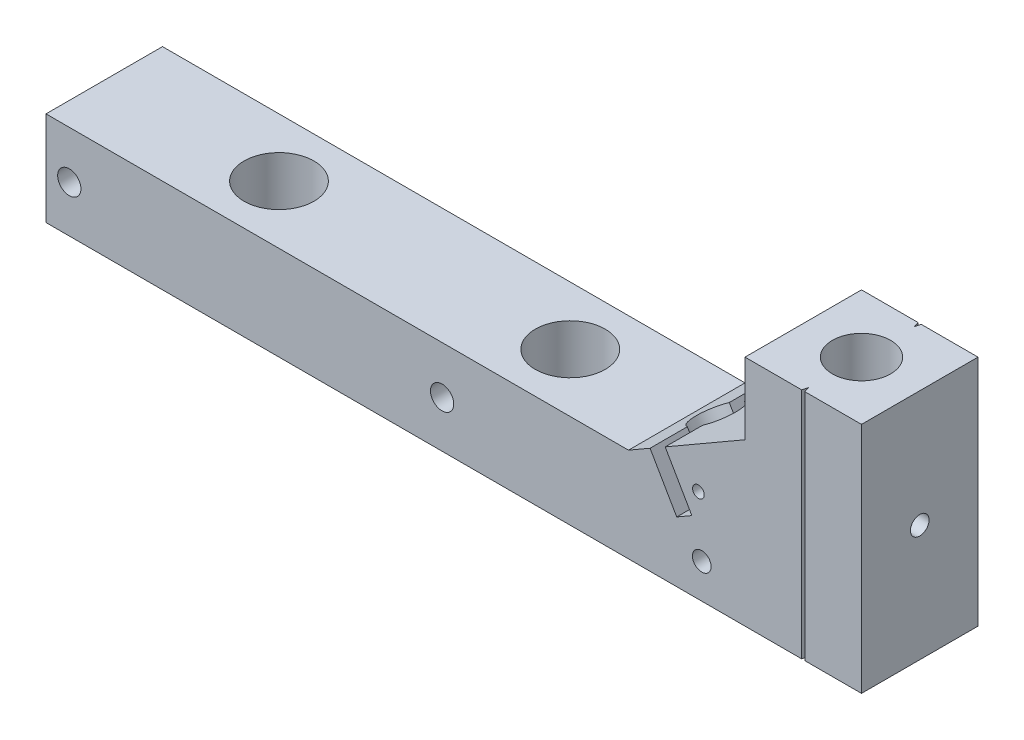
from build123d import *

# Parameters (mm, degrees)
SKETCH1_W                 = 20
SKETCH1_H                 = 10
BOSS_EXTRUDE1_DEPTH       = 20
SKETCH2_R                 = 2.5
CUT_EXTRUDE1_DEPTH        = 26.836409614
CUT_EXTRUDE2_DEPTH        = 27.191969955
SKETCH5_R                 = 1.95
CUT_EXTRUDE5_DEPTH        = 21.021203074
M2X0_4_TAPPED_HOLE1_D     = 1.6
M2X0_4_TAPPED_HOLE1_DEPTH = 6
M2X0_4_TAPPED_HOLE1_TIP   = 0.480688495
M2X0_4_TAPPED_HOLE2_D     = 1.6
M2X0_4_TAPPED_HOLE2_DEPTH = 6
M2X0_4_TAPPED_HOLE2_TIP   = 0.480688495
SKETCH14_W                = 10
SKETCH14_H                = 8.082903769
BOSS_EXTRUDE3_DEPTH       = 50
CUT_EXTRUDE7_REACH        = 67.371
SKETCH15_R                = 3
SKETCH16_R                = 1
CUT_EXTRUDE8_DEPTH        = 68.45300722
SKETCH18_R                = 0.5
CUT_EXTRUDE9_DEPTH        = 3


with BuildPart() as part:
    # Sketch1 → Boss-Extrude1 (new body)
    with BuildSketch(Plane(origin=(0, 0, 0), x_dir=(1, 0, 0), z_dir=(0, 1, 0))):
        with Locations((-3.638888889, 4.027777778)):
            Rectangle(SKETCH1_W, SKETCH1_H)
    extrude(amount=BOSS_EXTRUDE1_DEPTH)

    # Sketch2 → Cut-Extrude1 (cut, through all)
    with BuildSketch(Plane(origin=(0, 20, 0), x_dir=(1, 0, 0), z_dir=(0, 1, 0))):
        with Locations((1.361111111, 4.027777778)):
            Circle(SKETCH2_R)
        Polygon((1.495085707, -0.972222222), (1.361111111, -0.472222222), (1.227136515, -0.972222222), align=None)
        Polygon((1.361111111, 8.527777778), (1.227136515, 9.027777778), (1.495085707, 9.027777778), align=None)
    extrude(amount=-CUT_EXTRUDE1_DEPTH, mode=Mode.SUBTRACT)

    # Sketch3 → Cut-Extrude2 (cut, through all)
    with BuildSketch(Plane.XY.offset(0.972222222)):
        Polygon((-13.638888889, 20), (-3.638888889, 20), (-3.638888889, 13.856406461), (-10.489369836, 9.901279442), (-8.200869836, 5.937481169), (-9.499907942, 5.187481169), (-11.788407942, 9.151279442), (-13.638888889, 8.082903769), align=None)
    extrude(amount=-CUT_EXTRUDE2_DEPTH, mode=Mode.SUBTRACT)

    # Sketch5 → Cut-Extrude5 (cut, through all)
    with BuildSketch(Plane(origin=(-6.909722222, 11.967989955, 0), x_dir=(0.8660254037844415, 0.49999999999999534, 0), z_dir=(-0.49999999999999534, 0.8660254037844415, 0))):
        with Locations((-4.883421027, 4.027777778)):
            Circle(SKETCH5_R)
    extrude(amount=-CUT_EXTRUDE5_DEPTH, mode=Mode.SUBTRACT)

    # M2x0.4 Tapped Hole1
    with Locations(Plane(origin=(6.361111111, 0, 0), x_dir=(0, 0, -1), z_dir=(1, 0, 0))):
        with Locations((4.027777778, 10)):
            Hole(M2X0_4_TAPPED_HOLE1_D / 2, depth=M2X0_4_TAPPED_HOLE1_DEPTH)
            with Locations((0, 0, -(M2X0_4_TAPPED_HOLE1_DEPTH + M2X0_4_TAPPED_HOLE1_TIP / 2))):  # 118° drill point
                Cone(0, M2X0_4_TAPPED_HOLE1_D / 2, M2X0_4_TAPPED_HOLE1_TIP, mode=Mode.SUBTRACT)

    # M2x0.4 Tapped Hole2
    with Locations(Plane.XY.offset(0.972222222)):
        with Locations((-7.350388889, 2.964404957)):
            Hole(M2X0_4_TAPPED_HOLE2_D / 2, depth=M2X0_4_TAPPED_HOLE2_DEPTH)
            with Locations((0, 0, -(M2X0_4_TAPPED_HOLE2_DEPTH + M2X0_4_TAPPED_HOLE2_TIP / 2))):  # 118° drill point
                Cone(0, M2X0_4_TAPPED_HOLE2_D / 2, M2X0_4_TAPPED_HOLE2_TIP, mode=Mode.SUBTRACT)

    # Sketch14 → Boss-Extrude3 (add)
    with BuildSketch(Plane.ZY.offset(13.638888889)):
        with Locations((-4.027777778, 4.041451884)):
            Rectangle(SKETCH14_W, SKETCH14_H)
    extrude(amount=BOSS_EXTRUDE3_DEPTH)

    # Sketch15 → Cut-Extrude7 (cut, up to next)
    with BuildSketch(Plane(origin=(0, 8.082903769, 0), x_dir=(1, 0, 0), z_dir=(0, 1, 0)), mode=Mode.PRIVATE) as cut_extrude7_sk1:
        with Locations((-48.638888889, 4.027777778)):
            Circle(SKETCH15_R)
    cut_extrude7_tool1 = extrude(cut_extrude7_sk1.sketch, amount=-CUT_EXTRUDE7_REACH, mode=Mode.PRIVATE) & part.part
    # Sketch15 → Cut-Extrude7 (cut, up to next)
    with BuildSketch(Plane(origin=(0, 8.082903769, 0), x_dir=(1, 0, 0), z_dir=(0, 1, 0)), mode=Mode.PRIVATE) as cut_extrude7_sk2:
        with Locations((-23.638888889, 4.027777778)):
            Circle(SKETCH15_R)
    cut_extrude7_tool2 = extrude(cut_extrude7_sk2.sketch, amount=-CUT_EXTRUDE7_REACH, mode=Mode.PRIVATE) & part.part
    add(cut_extrude7_tool1.solids().sort_by_distance((-48.638889, 8.082904, -4.027778))[0], mode=Mode.SUBTRACT)
    add(cut_extrude7_tool2.solids().sort_by_distance((-23.638889, 8.082904, -4.027778))[0], mode=Mode.SUBTRACT)

    # Sketch16 → Cut-Extrude8 (cut, through all)
    with BuildSketch(Plane.XY.offset(0.972222222)):
        with Locations((-61.638888889, 4)):
            Circle(SKETCH16_R)
        with Locations((-29.638888889, 4)):
            Circle(SKETCH16_R)
    extrude(amount=-CUT_EXTRUDE8_DEPTH, mode=Mode.SUBTRACT)

    # Sketch18 → Cut-Extrude9 (cut)
    with BuildSketch(Plane.XY.offset(0.972222222)):
        with Locations((-7.638888889, 8)):
            Circle(SKETCH18_R)
    extrude(amount=-CUT_EXTRUDE9_DEPTH, mode=Mode.SUBTRACT)


solid = part.part
